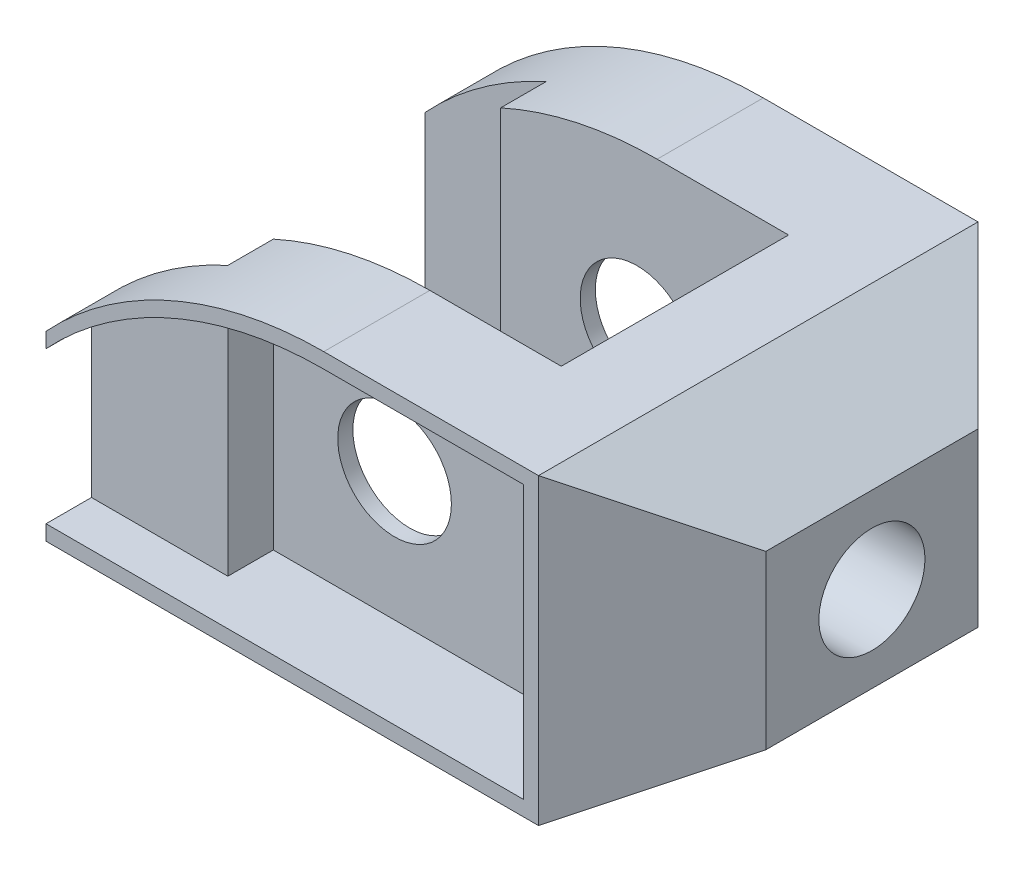
from build123d import *

# Parameters (mm, degrees)
SKETCH1_W           = 80
SKETCH1_H           = 58
BOSS_EXTRUDE1_DEPTH = 40
SKETCH2_R           = 7.5
CUT_EXTRUDE1_DEPTH  = 95
CUT_EXTRUDE4_DEPTH  = 95
SKETCH7_W           = 36.66060556
SKETCH7_H           = 15
SKETCH7_W_2         = 17.33939444
CUT_EXTRUDE5_DEPTH  = 95
SKETCH8_W           = 16
SKETCH8_H           = 42
CUT_EXTRUDE6_DEPTH  = 95
SKETCH9_R           = 7
CUT_EXTRUDE7_DEPTH  = 95
SKETCH15_R          = 7.5
CUT_EXTRUDE18_DEPTH = 12
CUT_EXTRUDE19_DEPTH = 6
CUT_EXTRUDE20_START = -12
SKETCH19_R          = 7.5
CUT_EXTRUDE20_DEPTH = 12
CUT_EXTRUDE21_START = -6
CUT_EXTRUDE21_DEPTH = 6


with BuildPart() as part:
    # Sketch1 → Boss-Extrude1 (new body)
    with BuildSketch(Plane(origin=(0, 0, 0), x_dir=(1, 0, 0), z_dir=(0, 1, 0))):
        Rectangle(SKETCH1_W, SKETCH1_H)
    extrude(amount=BOSS_EXTRUDE1_DEPTH)

    # Sketch2 → Cut-Extrude1 (cut)
    with BuildSketch(Plane.XY.offset(29)):
        with Locations((-6, 19)):
            Circle(SKETCH2_R)
        Polygon((25, 0), (40, 0), (40, 8.660254038), align=None)
        Polygon((25, 40), (40, 40), (40, 31.339745962), align=None)
    extrude(amount=-CUT_EXTRUDE1_DEPTH, mode=Mode.SUBTRACT)

    # Sketch4 → Cut-Extrude4 (cut)
    with BuildSketch(Plane.XY.offset(29)):
        with BuildLine():
            ThreePointArc((-40, 24), (-23.33939444, 35.82575695), (-3.33939444, 40))
            Line((-3.33939444, 40), (-40, 40))
            Line((-40, 40), (-40, 24))
        make_face()
    extrude(amount=-CUT_EXTRUDE4_DEPTH, mode=Mode.SUBTRACT)

    # Sketch7 → Cut-Extrude5 (cut)
    with BuildSketch(Plane(origin=(0, 40, 0), x_dir=(1, 0, 0), z_dir=(0, 1, 0))):
        with Locations((-21.66969722, -7.5)):
            Rectangle(SKETCH7_W, SKETCH7_H)
        with Locations((-21.66969722, 7.5)):
            Rectangle(SKETCH7_W, SKETCH7_H)
        with Locations((5.33030278, 7.5)):
            Rectangle(SKETCH7_W_2, SKETCH7_H)
        with Locations((5.33030278, -7.5)):
            Rectangle(SKETCH7_W_2, SKETCH7_H)
        Polygon((40, 14), (40, 29), (25, 29), align=None)
        Polygon((40, -29), (25, -29), (40, -14), align=None)
    extrude(amount=-CUT_EXTRUDE5_DEPTH, mode=Mode.SUBTRACT)

    # Sketch8 → Cut-Extrude6 (cut)
    with BuildSketch(Plane(origin=(0, 40, 0), x_dir=(1, 0, 0), z_dir=(0, 1, 0))):
        with Locations((-32, 0)):
            Rectangle(SKETCH8_W, SKETCH8_H)
    extrude(amount=-CUT_EXTRUDE6_DEPTH, mode=Mode.SUBTRACT)

    # Sketch9 → Cut-Extrude7 (cut)
    with BuildSketch(Plane(origin=(40, 0, 0), x_dir=(0, 0, -1), z_dir=(1, 0, 0))):
        with Locations((0, 20)):
            Circle(SKETCH9_R)
    extrude(amount=-CUT_EXTRUDE7_DEPTH, mode=Mode.SUBTRACT)

    # Sketch15 → Cut-Extrude18 (cut)
    with BuildSketch(Plane.XY.offset(29)):
        with BuildLine():
            Line((23, 2), (23, 38))
            Line((23, 38), (-3.339394, 38))
            ThreePointArc((-3.339394, 38), (-12.842943372, 37.088517575), (-22, 34.387302143))
            Line((-22, 34.387302143), (-22, 2))
            Line((-22, 2), (23, 2))
        make_face()
        with Locations((-6, 19)):
            Circle(SKETCH15_R, mode=Mode.SUBTRACT)
    extrude(amount=-CUT_EXTRUDE18_DEPTH, mode=Mode.SUBTRACT)

    # Sketch18 → Cut-Extrude19 (cut)
    with BuildSketch(Plane.XY.offset(29)):
        with BuildLine():
            Line((-22, 34.387302143), (-22, 2))
            Line((-22, 2), (-40, 2))
            Line((-40, 2), (-40, 22))
            ThreePointArc((-40, 22), (-31.684948122, 29.18894981), (-22, 34.387302143))
        make_face()
    extrude(amount=-CUT_EXTRUDE19_DEPTH, mode=Mode.SUBTRACT)

    # Sketch19 → Cut-Extrude20 (cut)
    with BuildSketch(Plane(origin=(0, 0, -29), x_dir=(-1, 0, 0), z_dir=(0, 0, -1)).offset(CUT_EXTRUDE20_START)):
        with BuildLine():
            Line((3.339394, 38), (-23, 38))
            Line((-23, 38), (-23, 2))
            Line((-23, 2), (22, 2))
            Line((22, 2), (22, 34.387302143))
            ThreePointArc((22, 34.387302143), (12.842943372, 37.088517575), (3.339394, 38))
        make_face()
        with Locations(Location((6, 19, 0), (0, 0, 180))):
            Circle(SKETCH19_R, mode=Mode.SUBTRACT)
    extrude(amount=CUT_EXTRUDE20_DEPTH, mode=Mode.SUBTRACT)

    # Sketch20 → Cut-Extrude21 (cut)
    with BuildSketch(Plane(origin=(0, 0, -29), x_dir=(-1, 0, 0), z_dir=(0, 0, -1)).offset(CUT_EXTRUDE21_START)):
        with BuildLine():
            Line((22, 34.387302143), (22, 2))
            Line((22, 2), (40, 2))
            Line((40, 2), (40, 22))
            ThreePointArc((40, 22), (31.684948122, 29.18894981), (22, 34.387302143))
        make_face()
    extrude(amount=CUT_EXTRUDE21_DEPTH, mode=Mode.SUBTRACT)


solid = part.part
